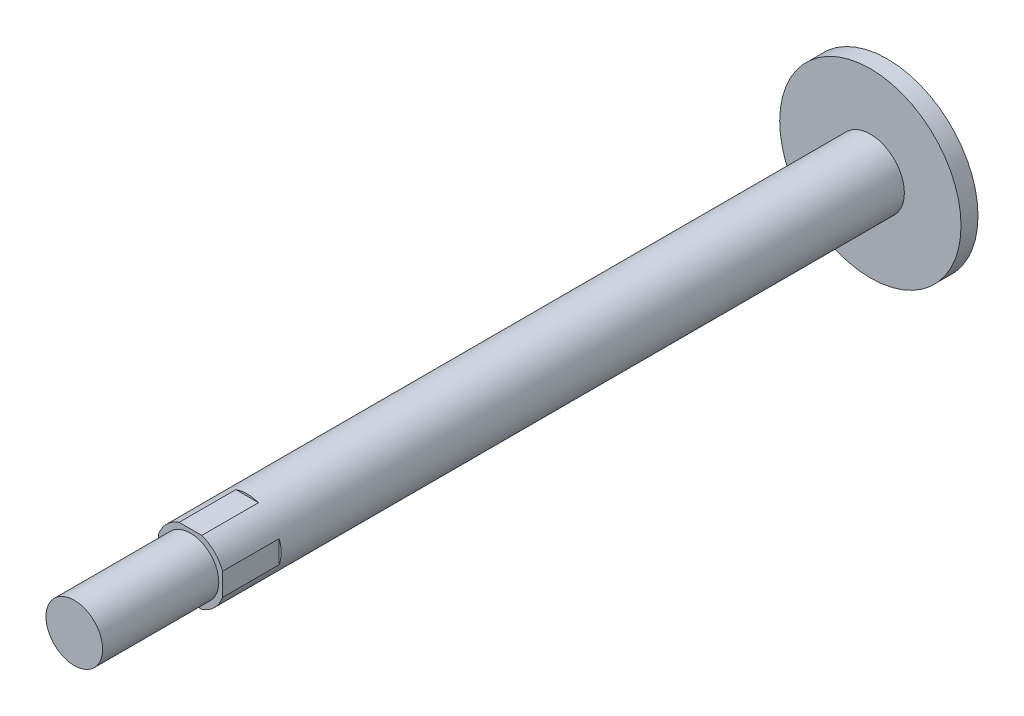
from build123d import *

# Parameters (mm, degrees)
CUT_EXTRUDE_START        = -10
CUT_EXTRUDE_1_DEPTH      = 10
PATTERN_CIRCULAR_1_COUNT = 4
SCALE_1_SCALE            = 0.75


with BuildPart() as part:
    # 草图2 → 旋转1 (revolve)
    with BuildSketch(Plane(origin=(0, 0, 0), x_dir=(0, 0, -1), z_dir=(1, 0, 0))):
        Polygon((0, 0), (-143.5, 0), (-143.5, 5), (-123, 5), (-123, 6), (-3, 6), (-3, 16), (0, 16), align=None)
    revolve(axis=Axis((0, 0, 0), (0, 0, 1)))

    # 草图7 → 切除-拉伸1 (cut)
    with BuildSketch(Plane.XY.offset(123).offset(CUT_EXTRUDE_START)):
        with BuildLine():
            Line((5.656854249, 2), (5.656854249, -2))
            ThreePointArc((5.656854249, -2), (6, 0), (5.656854249, 2))
        make_face()
        with BuildLine():
            Line((-5.656854249, 2), (-5.656854249, -2))
            ThreePointArc((-5.656854249, -2), (-6, 0), (-5.656854249, 2))
        make_face()
    cut_extrude_1 = extrude(amount=CUT_EXTRUDE_1_DEPTH, mode=Mode.SUBTRACT)

    # 阵列(圆周)1: 切除-拉伸1 ×4 about axis
    pattern_circular_1_axis = Axis((0, 0, 0), (0, 0, -1))
    for i in range(1, PATTERN_CIRCULAR_1_COUNT):
        add(cut_extrude_1.rotate(pattern_circular_1_axis, i * 360 / PATTERN_CIRCULAR_1_COUNT), mode=Mode.SUBTRACT)


with BuildPart() as part_1:
    # 缩放比例1: scaled about (0, 0, 0)
    add(part.part.scale(SCALE_1_SCALE))


solid = part_1.part
